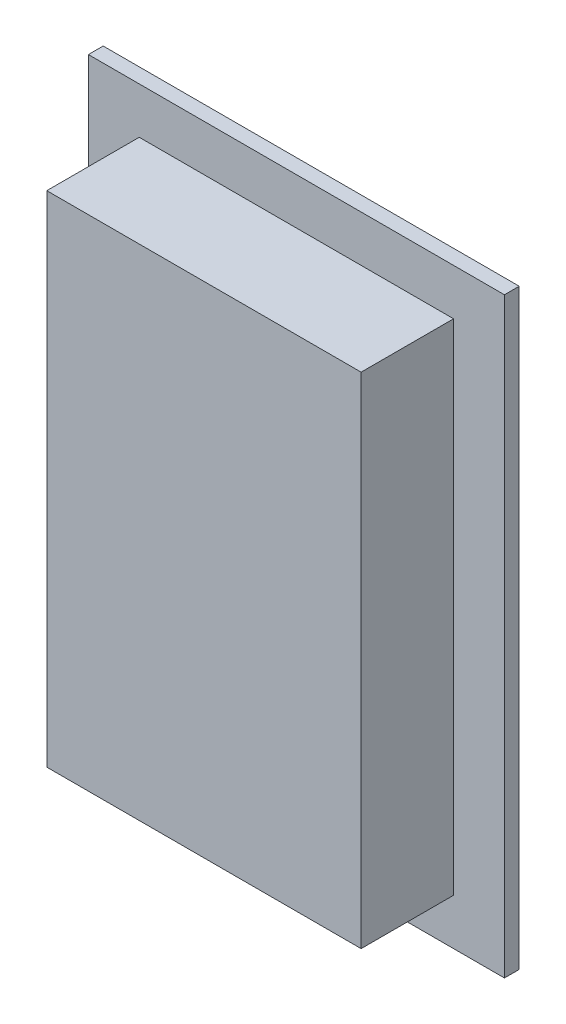
from build123d import *

# Parameters (mm, degrees)
BOSS_EXTRUDE1_START = 18.4
SKETCH1_W           = 45
SKETCH1_H           = 64
BOSS_EXTRUDE1_DEPTH = 0.8
BOSS_EXTRUDE2_START = 24.2
SKETCH2_W           = 34
SKETCH2_H           = 54
BOSS_EXTRUDE2_DEPTH = 5


with BuildPart() as part:
    # Sketch1 → Boss-Extrude1 (new, symmetric)
    with BuildSketch(Plane.XY.offset(BOSS_EXTRUDE1_START)):
        with Locations((-75, 0)):
            Rectangle(SKETCH1_W, SKETCH1_H)
    extrude(amount=BOSS_EXTRUDE1_DEPTH, both=True)

    # Sketch2 → Boss-Extrude2 (add, symmetric)
    with BuildSketch(Plane.XY.offset(BOSS_EXTRUDE2_START)):
        with Locations((-75, 0)):
            Rectangle(SKETCH2_W, SKETCH2_H)
    extrude(amount=BOSS_EXTRUDE2_DEPTH, both=True)


solid = part.part
